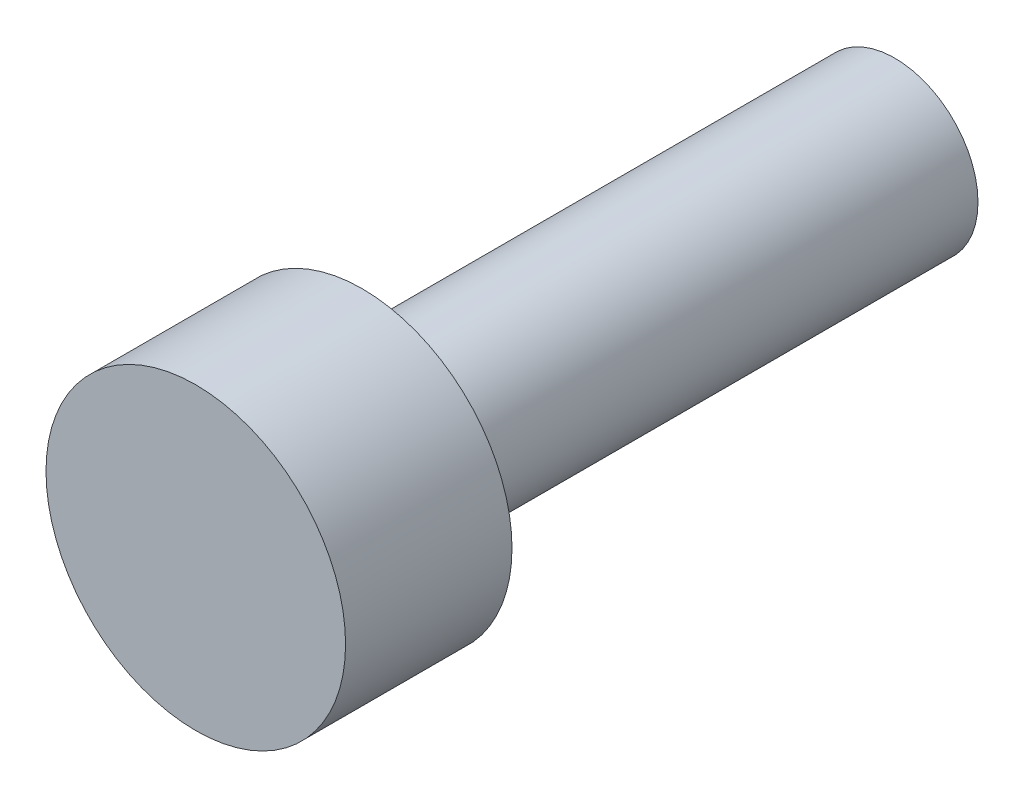
from build123d import *

# Parameters (mm, degrees)
SKETCH1_R           = 2.5
BOSS_EXTRUDE1_DEPTH = 16
SKETCH2_R           = 4.5
BOSS_EXTRUDE2_DEPTH = 5


with BuildPart() as part:
    # Sketch1 → Boss-Extrude1 (new body)
    with BuildSketch(Plane.XY):
        Circle(SKETCH1_R)
    extrude(amount=BOSS_EXTRUDE1_DEPTH)

    # Sketch2 → Boss-Extrude2 (add)
    with BuildSketch(Plane.XY.offset(16)):
        Circle(SKETCH2_R)
    extrude(amount=BOSS_EXTRUDE2_DEPTH)


solid = part.part
